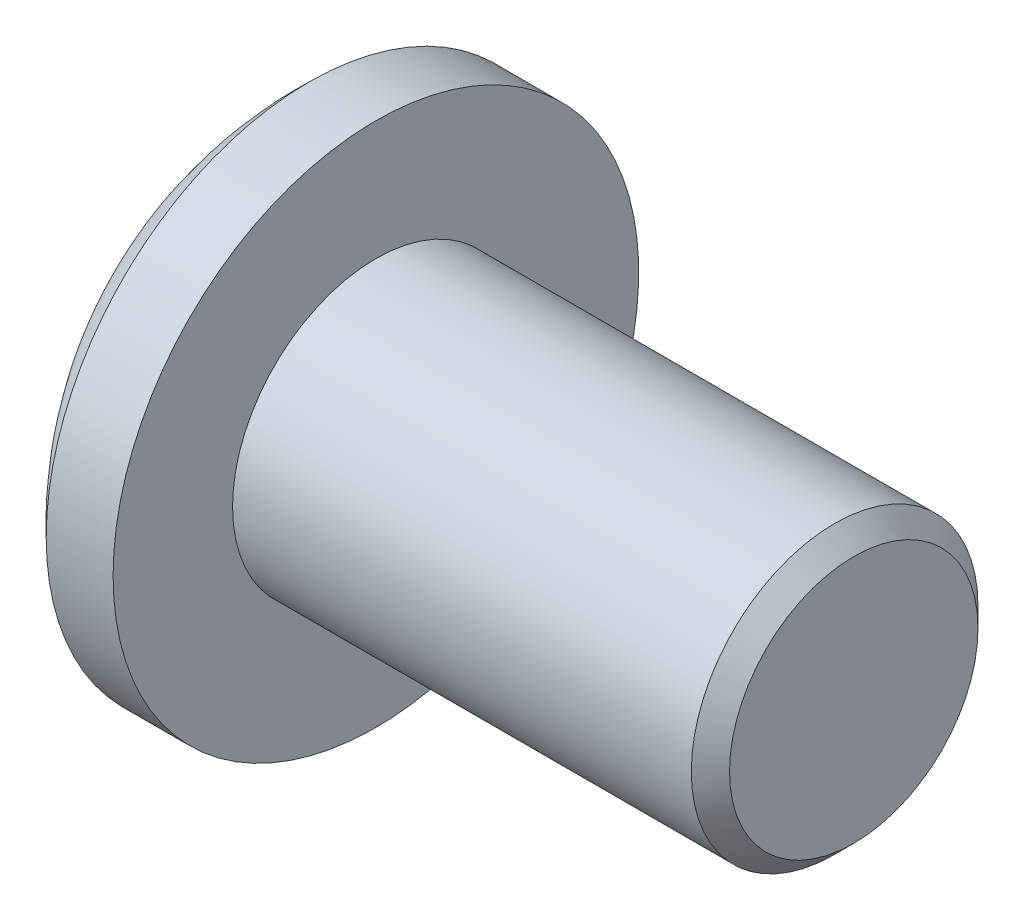
from build123d import *

# Parameters (mm, degrees)
CUT_EXTRUDE_START   = -0.5
CUT_EXTRUDE_1_DEPTH = 6.83442973
CHAMFER_1_SIZE      = 0.2


with BuildPart() as part:
    # 草图1 → 旋转1 (revolve)
    with BuildSketch(Plane.XY, mode=Mode.PRIVATE) as revolve_1_sk:
        with BuildLine():
            Line((1.2, 2.75), (1.9, 2.75))
            Line((1.9, 2.75), (1.9, 1.5))
            Line((1.9, 1.5), (6.9, 1.5))
            Line((6.9, 1.5), (6.9, 0))
            Line((6.9, 0), (0, 0))
            ThreePointArc((0, 0), (0.313064269, 1.500208319), (1.2, 2.75))
        make_face()
    revolve(revolve_1_sk.sketch.rotate(Axis((0, 0, 0), (1, 0, 0)), 90), axis=Axis((0, 0, 0), (1, 0, 0)))

    # 草图2 → 切除-拉伸1 (cut, through all)
    with BuildSketch(Plane(origin=(1.9, 0, 0), x_dir=(0, 0, -1), z_dir=(1, 0, 0)).offset(CUT_EXTRUDE_START)):
        Polygon((0.35, -0.35), (0.35, -1.5), (-0.35, -1.5), (-0.35, -0.35), (-1.5, -0.35), (-1.5, 0.35), (-0.35, 0.35), (-0.35, 1.5), (0.35, 1.5), (0.35, 0.35), (1.5, 0.35), (1.5, -0.35), align=None)
    extrude(amount=-CUT_EXTRUDE_1_DEPTH, mode=Mode.SUBTRACT)

    # 草图3 → 旋转3 (revolve)
    with BuildSketch(Plane.XY, mode=Mode.PRIVATE) as revolve_3_sk:
        Polygon((1.9, 0), (1.9, 2), (0.9, 2), (1.4, 0), align=None)
    revolve(revolve_3_sk.sketch.rotate(Axis((0, 0, 0), (1, 0, 0)), 13.134022306), axis=Axis((0, 0, 0), (1, 0, 0)))

    # 倒角1
    chamfer_1_edges = [part.edges().sort_by_distance(p)[0] for p in [
        (6.9, 0, -1.5),
    ]]
    chamfer(chamfer_1_edges, length=CHAMFER_1_SIZE)


solid = part.part
